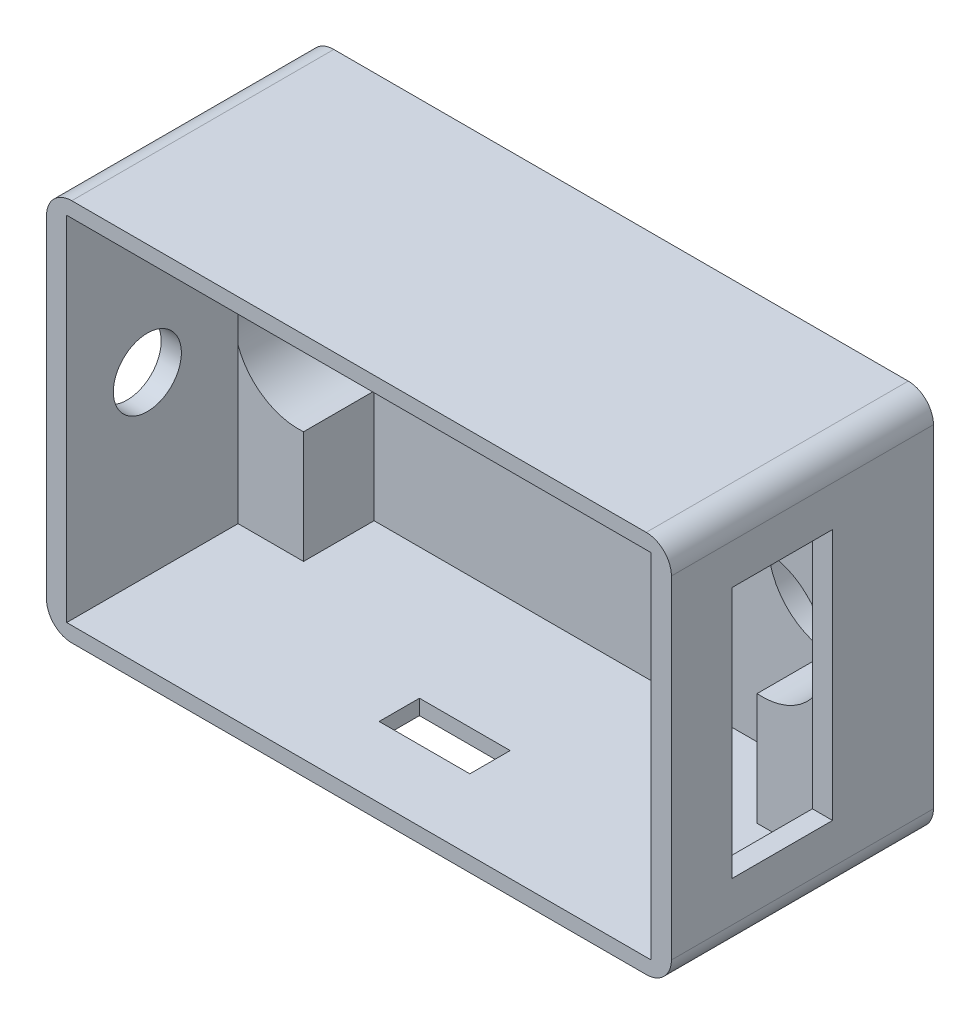
from build123d import *

# Parameters (mm, degrees)
SKETCH1_W           = 62
SKETCH1_H           = 38
BOSS_EXTRUDE1_DEPTH = 26
SKETCH2_W           = 58
SKETCH2_H           = 35
CUT_EXTRUDE1_DEPTH  = 17
SKETCH4_W           = 45
SKETCH4_H           = 35
CUT_EXTRUDE3_DEPTH  = 7
SKETCH5_R           = 6.375
CUT_EXTRUDE4_DEPTH  = 9
SKETCH6_W           = 9.989337028
SKETCH6_H           = 25
CUT_EXTRUDE5_DEPTH  = 17
SKETCH7_R           = 3.375
CUT_EXTRUDE6_DEPTH  = 7
SKETCH8_W           = 9
SKETCH8_H           = 4
CUT_EXTRUDE7_DEPTH  = 7
FILLET1_R           = 2.5


with BuildPart() as part:
    # Sketch1 → Boss-Extrude1 (new body)
    with BuildSketch(Plane.XY):
        with Locations((31, 19)):
            Rectangle(SKETCH1_W, SKETCH1_H)
    extrude(amount=BOSS_EXTRUDE1_DEPTH)

    # Sketch2 → Cut-Extrude1 (cut)
    with BuildSketch(Plane.XY.offset(26)):
        with Locations((31, 19)):
            Rectangle(SKETCH2_W, SKETCH2_H)
    extrude(amount=-CUT_EXTRUDE1_DEPTH, mode=Mode.SUBTRACT)

    # Sketch4 → Cut-Extrude3 (cut)
    with BuildSketch(Plane.XY.offset(9)):
        with Locations((31, 19)):
            Rectangle(SKETCH4_W, SKETCH4_H)
    extrude(amount=-CUT_EXTRUDE3_DEPTH, mode=Mode.SUBTRACT)

    # Sketch5 → Cut-Extrude4 (cut)
    with BuildSketch(Plane(origin=(0, 0, 0), x_dir=(-1, 0, 0), z_dir=(0, 0, -1))):
        with Locations((-54, 19)):
            Circle(SKETCH5_R)
        with Locations((-8, 19)):
            Circle(SKETCH5_R)
    extrude(amount=-CUT_EXTRUDE4_DEPTH, mode=Mode.SUBTRACT)

    # Sketch6 → Cut-Extrude5 (cut)
    with BuildSketch(Plane(origin=(62, 0, 0), x_dir=(0, 0, -1), z_dir=(1, 0, 0))):
        with Locations((-15.005331486, 19)):
            Rectangle(SKETCH6_W, SKETCH6_H)
    extrude(amount=-CUT_EXTRUDE5_DEPTH, mode=Mode.SUBTRACT)

    # Sketch7 → Cut-Extrude6 (cut)
    with BuildSketch(Plane.ZY):
        with Locations((18, 19)):
            Circle(SKETCH7_R)
    extrude(amount=-CUT_EXTRUDE6_DEPTH, mode=Mode.SUBTRACT)

    # Sketch8 → Cut-Extrude7 (cut)
    with BuildSketch(Plane.XZ):
        with Locations((30.5, 17)):
            Rectangle(SKETCH8_W, SKETCH8_H)
    extrude(amount=-CUT_EXTRUDE7_DEPTH, mode=Mode.SUBTRACT)

    # Fillet1
    fillet1_edges = [part.edges().sort_by_distance(p)[0] for p in [
        (0, 38, 13),
        (62, 38, 13),
        (62, 0, 13),
        (0, 0, 13),
    ]]
    fillet(fillet1_edges, radius=FILLET1_R)


solid = part.part
